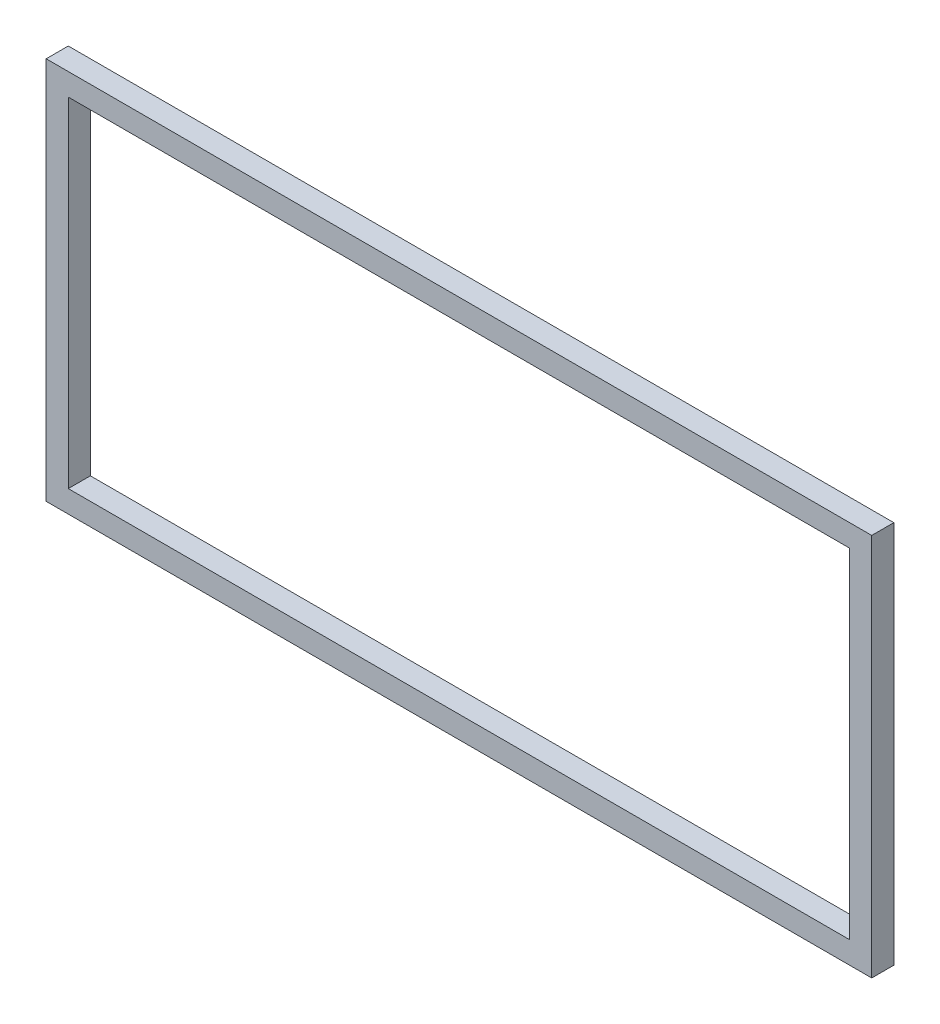
from build123d import *

# Parameters (mm, degrees)
SKETCH1_W           = 1120
SKETCH1_H           = 520
SKETCH1_W_2         = 1060
SKETCH1_H_2         = 460
BOSS_EXTRUDE1_DEPTH = 30


with BuildPart() as part:
    # Sketch1 → Boss-Extrude1 (new body)
    with BuildSketch(Plane.XY):
        Rectangle(SKETCH1_W, SKETCH1_H)
        Rectangle(SKETCH1_W_2, SKETCH1_H_2, mode=Mode.SUBTRACT)
    extrude(amount=BOSS_EXTRUDE1_DEPTH)


solid = part.part
